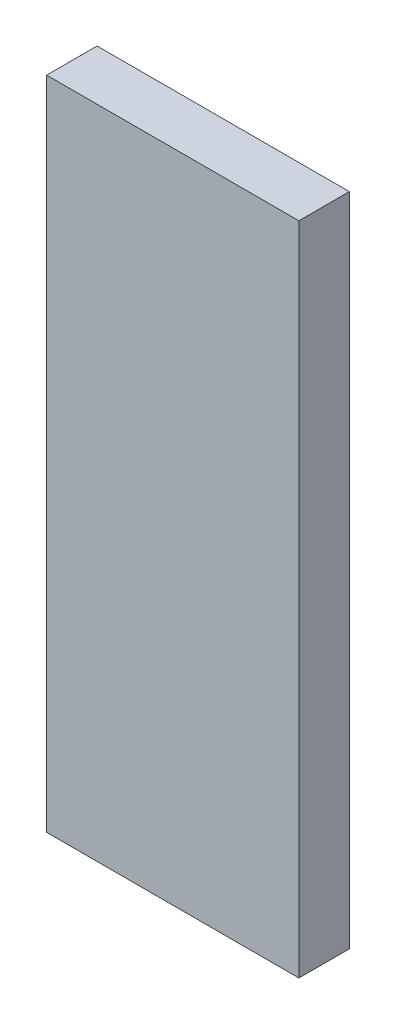
from build123d import *

# Parameters (mm, degrees)
SKETCH_1_W      = 25
SKETCH_1_H      = 5
EXTRUDE_1_DEPTH = 65


with BuildPart() as part:
    # 草图1 → 凸台-拉伸1 (new body)
    with BuildSketch(Plane(origin=(0, 0, 0), x_dir=(1, 0, 0), z_dir=(0, 1, 0))):
        Rectangle(SKETCH_1_W, SKETCH_1_H)
    extrude(amount=EXTRUDE_1_DEPTH)


solid = part.part
